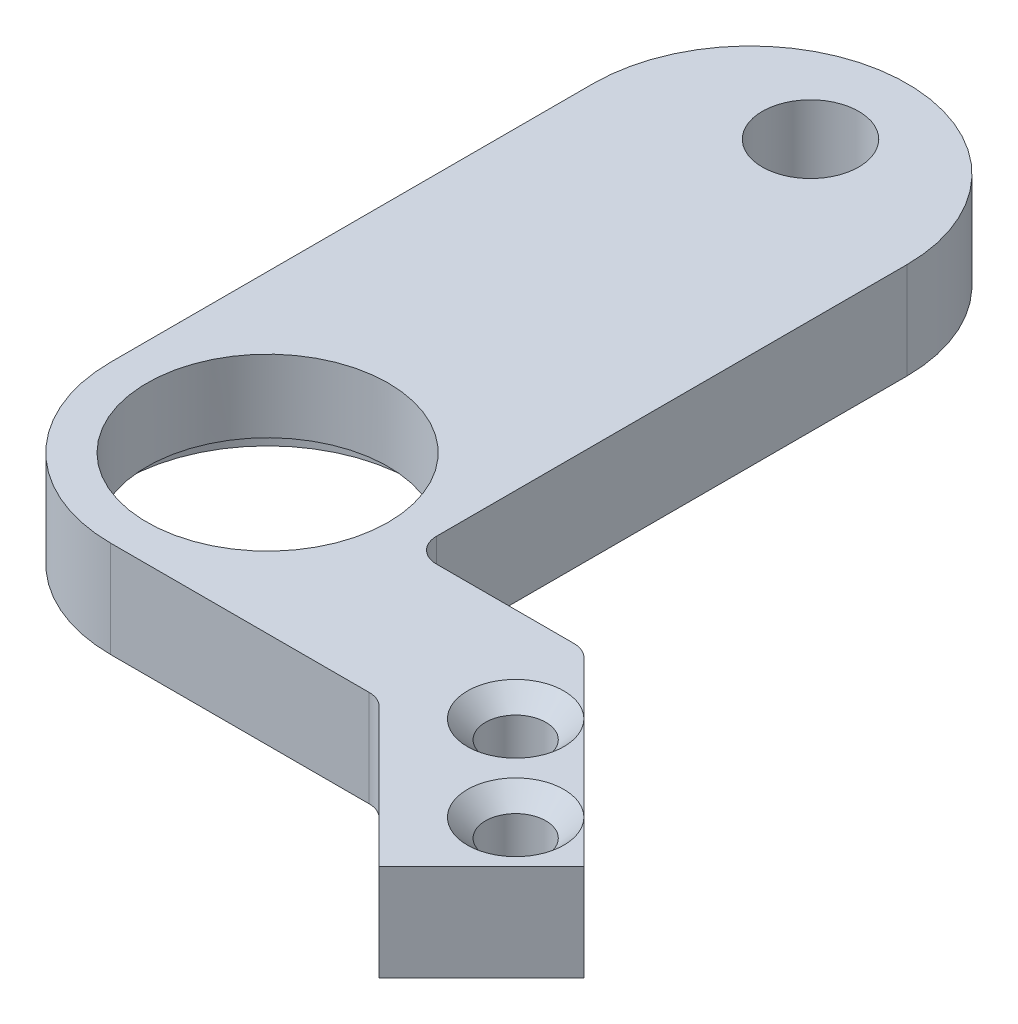
from build123d import *

# Parameters (mm, degrees)
BOSS_EXTRUDE1_DEPTH           = 4
DRAFT1_ANGLE                  = 45.000000004
DRAFT2_ANGLE                  = 45.000000005
F_4_0_4_DIAMETER_HOLE1_D      = 4
FILLET1_R                     = 1
FILLET2_R                     = 6.5
CSK_FOR_M3_SFHCS2_D           = 2.5
CSK_FOR_M3_SFHCS2_CSINK_D     = 4
CSK_FOR_M3_SFHCS2_CSINK_ANGLE = 90


with BuildPart() as part:
    # Sketch1 → Boss-Extrude1 (new body)
    with BuildSketch(Plane.XZ.offset(2)):
        with BuildLine():
            Line((11.124319466, 26.5), (-6.5, 26.5))
            Line((-6.5, 26.5), (-6.5, 0))
            ThreePointArc((-6.5, 0), (3e-09, -6.500000003), (6.500000005, 0))
            Line((6.500000005, 0), (6.500000005, 20.5))
            Line((6.500000005, 20.5), (13.60960084, 20.5))
            Line((13.60960084, 20.5), (13.60960084, 36.100603473))
            Line((13.60960084, 36.100603473), (11.124319466, 38.585884847))
            Line((11.124319466, 38.585884847), (11.124319466, 26.5))
        make_face()
    extrude(amount=-BOSS_EXTRUDE1_DEPTH)

    # Draft1
    draft1_faces = [part.faces().sort_by_distance(p)[0] for p in [
        (13.60960084, 0, 28.300301737),
    ]]
    draft(draft1_faces, Plane(origin=(6.500000005, 2, 20.5), x_dir=(-1, 0, 0), z_dir=(0, 0, -1)), DRAFT1_ANGLE)

    # Draft2
    draft2_faces = [part.faces().sort_by_distance(p)[0] for p in [
        (11.124319466, 0, 32.542942424),
    ]]
    draft(draft2_faces, Plane(origin=(11.124319466, 2, 26.5), x_dir=(1, 0, 0), z_dir=(0, 0, 1)), DRAFT2_ANGLE)

    # Sketch2 → Cut-Revolve1 (revolve, cut)
    with BuildSketch(Plane.XY.offset(20)):
        Polygon((0, 3.195464025), (0, -2), (6, -2), (6, -1), (5, -1), (5, 3.195464025), align=None)
    revolve(axis=Axis((0, 3.195464025, 20), (0, -1, 0)), mode=Mode.SUBTRACT)

    # Ø4.0 (4) Diameter Hole1 (through all)
    with Locations(Plane(origin=(0, 2, 0), x_dir=(1, 0, 0), z_dir=(0, 1, 0))):
        with Locations((0, 2.5)):
            Hole(F_4_0_4_DIAMETER_HOLE1_D / 2)

    # Fillet1
    fillet1_edges = [part.edges().sort_by_distance(p)[0] for p in [
        (13.60960084, 0, 20.5),
        (6.500000005, 0, 20.5),
        (11.124319466, 0, 26.5),
    ]]
    fillet(fillet1_edges, radius=FILLET1_R)

    # Fillet2
    fillet2_edges = [part.edges().sort_by_distance(p)[0] for p in [
        (-6.5, 0, 26.5),
    ]]
    fillet(fillet2_edges, radius=FILLET2_R)

    # CSK for M3 SFHCS2 (through all)
    with Locations(Plane(origin=(18.227922062, 2, 27.946748346), x_dir=(0, 0, 1), z_dir=(0, 1, 0))):
        with Locations((0, 0), (-3.535533906, -3.535533907)):
            CounterSinkHole(CSK_FOR_M3_SFHCS2_D / 2, CSK_FOR_M3_SFHCS2_CSINK_D / 2, counter_sink_angle=CSK_FOR_M3_SFHCS2_CSINK_ANGLE)


solid = part.part
